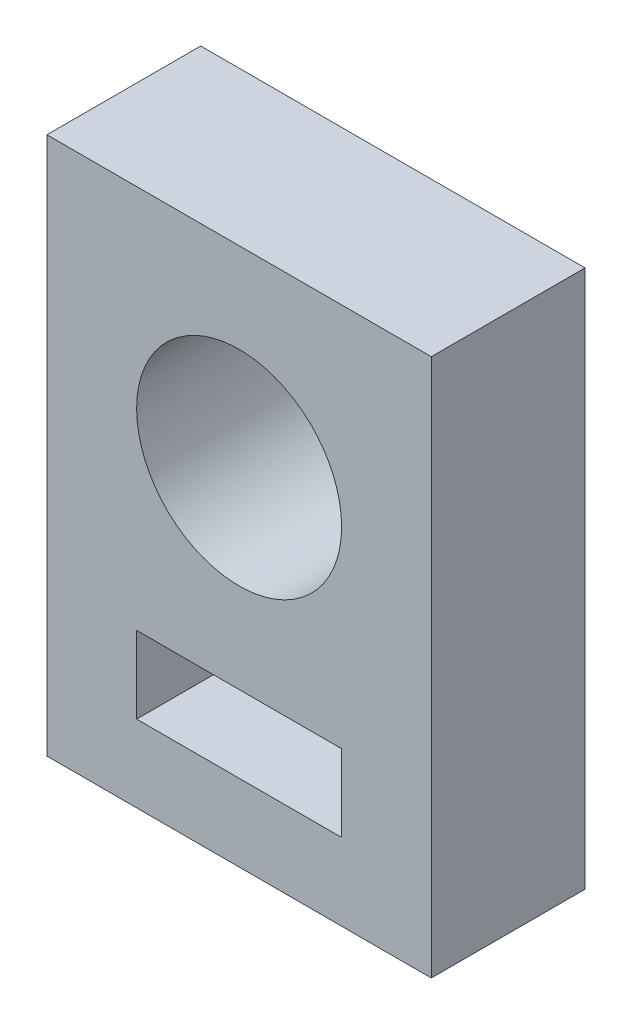
from build123d import *

# Parameters (mm, degrees)
SKETCH1_W           = 15
SKETCH1_H           = 21
SKETCH1_R           = 4
SKETCH1_W_2         = 8
SKETCH1_H_2         = 3
BOSS_EXTRUDE1_DEPTH = 6


with BuildPart() as part:
    # Sketch1 → Boss-Extrude1 (new body)
    with BuildSketch(Plane.XY):
        Rectangle(SKETCH1_W, SKETCH1_H)
        with Locations((0, 3)):
            Circle(SKETCH1_R, mode=Mode.SUBTRACT)
        with Locations((0, -6)):
            Rectangle(SKETCH1_W_2, SKETCH1_H_2, mode=Mode.SUBTRACT)
    extrude(amount=BOSS_EXTRUDE1_DEPTH)


solid = part.part
